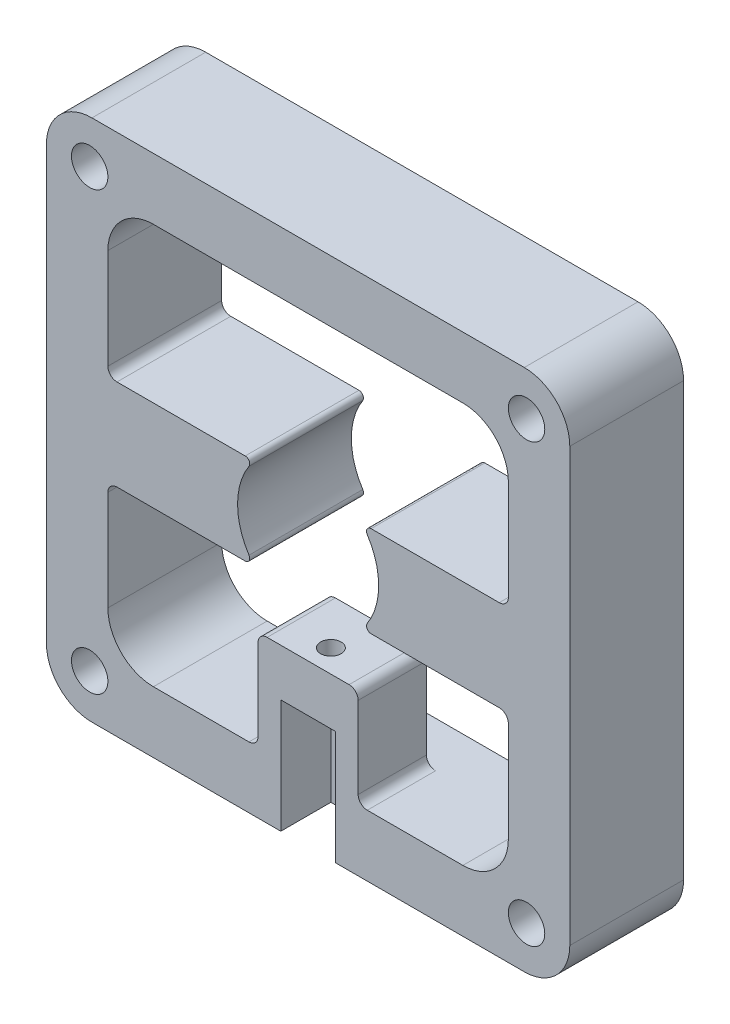
from build123d import *

# Parameters (mm, degrees)
SKETCH1_W           = 115
SKETCH1_H           = 115
BOSS_EXTRUDE1_DEPTH = 12.5
SKETCH2_R           = 4
CUT_EXTRUDE1_DEPTH  = 30
FILLET1_R           = 10
SKETCH5_W           = 88
SKETCH5_H           = 88
CUT_EXTRUDE3_DEPTH  = 30
FILLET4_R           = 10
SKETCH6_W           = 88
SKETCH6_H           = 20
BOSS_EXTRUDE2_DEPTH = 25
SKETCH14_W          = 22
SKETCH14_H          = 15
BOSS_EXTRUDE6_DEPTH = 30
SKETCH16_R          = 15.5
CUT_EXTRUDE7_DEPTH  = 30
FILLET6_R           = 1
FILLET8_R           = 2
SKETCH17_R          = 2.25
CUT_EXTRUDE8_DEPTH  = 40
SKETCH18_W          = 12
SKETCH18_H          = 12
CUT_EXTRUDE9_DEPTH  = 25


with BuildPart() as part:
    # Sketch1 → Boss-Extrude1 (new, symmetric)
    with BuildSketch(Plane.XY):
        Rectangle(SKETCH1_W, SKETCH1_H)
    extrude(amount=BOSS_EXTRUDE1_DEPTH, both=True)

    # Sketch2 → Cut-Extrude1 (cut)
    with BuildSketch(Plane.XY.offset(12.5)):
        with Locations((-48, 48)):
            Circle(SKETCH2_R)
        with Locations((48, 48)):
            Circle(SKETCH2_R)
        with Locations((48, -48)):
            Circle(SKETCH2_R)
        with Locations((-48, -48)):
            Circle(SKETCH2_R)
    extrude(amount=-CUT_EXTRUDE1_DEPTH, mode=Mode.SUBTRACT)

    # Fillet1
    fillet1_edges = [part.edges().sort_by_distance(p)[0] for p in [
        (-57.5, 57.5, 0),
        (57.5, 57.5, 0),
        (57.5, -57.5, 0),
        (-57.5, -57.5, 0),
    ]]
    fillet(fillet1_edges, radius=FILLET1_R)

    # Sketch5 → Cut-Extrude3 (cut)
    with BuildSketch(Plane.XY.offset(12.5)):
        Rectangle(SKETCH5_W, SKETCH5_H)
    extrude(amount=-CUT_EXTRUDE3_DEPTH, mode=Mode.SUBTRACT)

    # Fillet4
    fillet4_edges = [part.edges().sort_by_distance(p)[0] for p in [
        (-44, -44, 0),
        (-44, 44, 0),
        (44, 44, 0),
        (44, -44, 0),
    ]]
    fillet(fillet4_edges, radius=FILLET4_R)

    # Sketch6 → Boss-Extrude2 (add)
    with BuildSketch(Plane.XY.offset(12.5)):
        Rectangle(SKETCH6_W, SKETCH6_H)
    extrude(amount=-BOSS_EXTRUDE2_DEPTH)

    # Sketch14 → Boss-Extrude6 (add)
    with BuildSketch(Plane(origin=(0, -22.1, 0), x_dir=(-1, 0, 0), z_dir=(0, -1, 0))):
        with Locations((0, -5)):
            Rectangle(SKETCH14_W, SKETCH14_H)
    extrude(amount=BOSS_EXTRUDE6_DEPTH)

    # Sketch16 → Cut-Extrude7 (cut)
    with BuildSketch(Plane.XY.offset(12.5)):
        Circle(SKETCH16_R)
    extrude(amount=-CUT_EXTRUDE7_DEPTH, mode=Mode.SUBTRACT)

    # Fillet6
    fillet6_edges = [part.edges().sort_by_distance(p)[0] for p in [
        (-11.842719282, -10, 0),
        (11.842719282, -10, 0),
        (11.842719282, 10, 0),
        (-11.842719282, 10, 0),
    ]]
    fillet(fillet6_edges, radius=FILLET6_R)

    # Fillet8
    fillet8_edges = [part.edges().sort_by_distance(p)[0] for p in [
        (-44, -10, 0),
        (-44, 10, 0),
        (44, 10, 0),
        (44, -10, 0),
        (-11, -44, 5),
        (11, -44, 5),
        (11, -22.1, 5),
        (-11, -22.1, 5),
    ]]
    fillet(fillet8_edges, radius=FILLET8_R)

    # Sketch17 → Cut-Extrude8 (cut)
    with BuildSketch(Plane(origin=(0, -22.1, 0), x_dir=(1, 0, 0), z_dir=(0, 1, 0))):
        with Locations(Location((0, -7.5, 0), (0, 0, 180))):
            Circle(SKETCH17_R)
    extrude(amount=-CUT_EXTRUDE8_DEPTH, mode=Mode.SUBTRACT)

    # Sketch18 → Cut-Extrude9 (cut)
    with BuildSketch(Plane(origin=(0, -57.5, 0), x_dir=(-1, 0, 0), z_dir=(0, -1, 0))):
        with Locations((0, -7.5)):
            Rectangle(SKETCH18_W, SKETCH18_H)
    extrude(amount=-CUT_EXTRUDE9_DEPTH, mode=Mode.SUBTRACT)


solid = part.part
